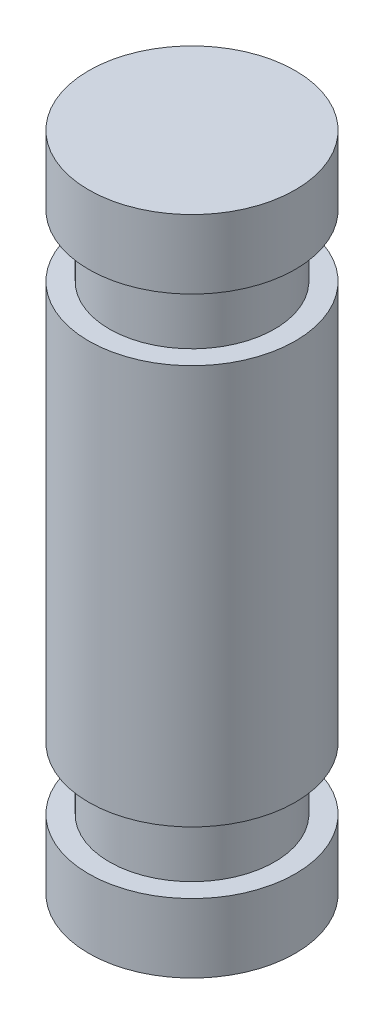
from build123d import *


with BuildPart() as part:
    # Sketch1 → Revolve1 (revolve)
    with BuildSketch(Plane.YZ, mode=Mode.PRIVATE) as revolve1_sk:
        Polygon((0, 0), (4.8, 0), (4.8, 1.5), (3.8, 1.5), (3.8, 1.2), (2.9, 1.2), (2.9, 1.5), (-2.9, 1.5), (-2.9, 1.2), (-3.8, 1.2), (-3.8, 1.5), (-4.8, 1.5), (-4.8, 0), align=None)
    revolve(revolve1_sk.sketch.rotate(Axis((0, 4.8, 0), (0, 1, 0)), 180), axis=Axis((0, 4.8, 0), (0, 1, 0)))


solid = part.part
